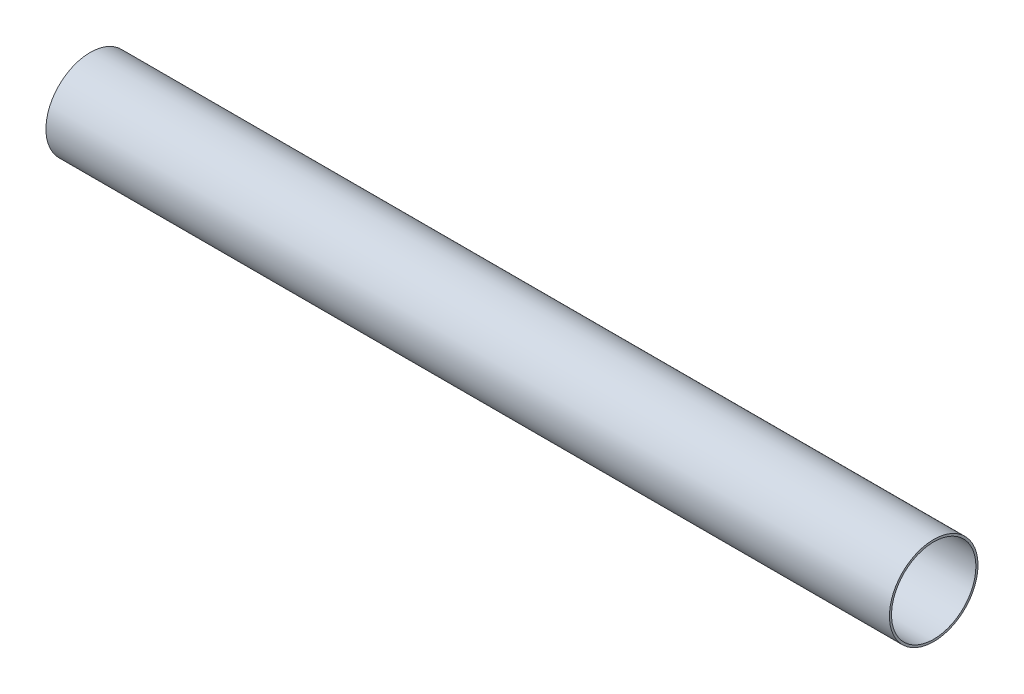
from build123d import *

# Parameters (mm, degrees)
SKETCH1_R           = 52.5
SKETCH1_R_2         = 50
BOSS_EXTRUDE1_DEPTH = 500


with BuildPart() as part:
    # Sketch1 → Boss-Extrude1 (new, symmetric)
    with BuildSketch(Plane(origin=(0, 0, 0), x_dir=(0, 0, -1), z_dir=(1, 0, 0))):
        Circle(SKETCH1_R)
        Circle(SKETCH1_R_2, mode=Mode.SUBTRACT)
    extrude(amount=BOSS_EXTRUDE1_DEPTH, both=True)


solid = part.part
